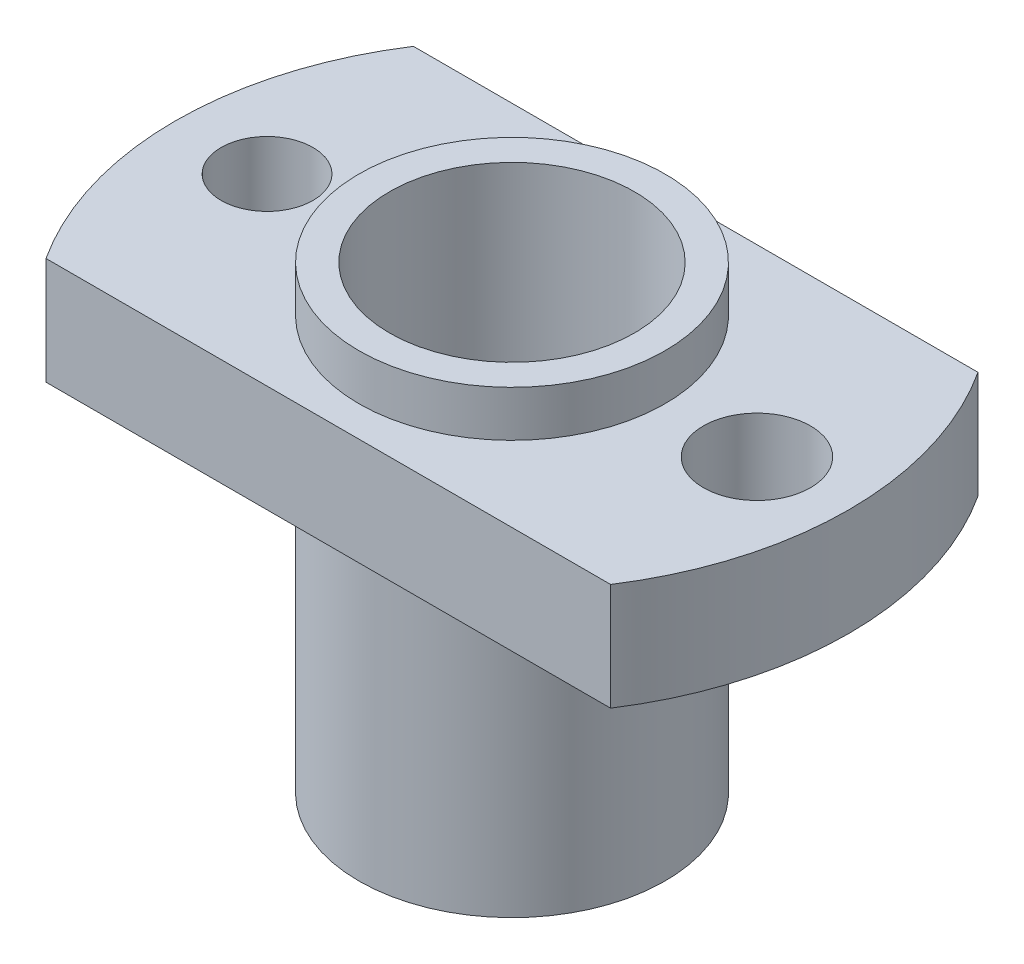
from build123d import *

# Parameters (mm, degrees)
EXTRUDE_1_DEPTH     = 3.5
CUT_EXTRUDE_START   = 3.5
SKETCH_2_R          = 1.75
SKETCH_2_R_2        = 1.5
CUT_EXTRUDE_1_DEPTH = 3.5
SKETCH_3_R          = 5
EXTRUDE_2_DEPTH     = 10
EXTRUDE_START       = 5
SKETCH_4_R          = 5
EXTRUDE_3_DEPTH     = 1.5
CUT_EXTRUDE_START_2 = -10
SKETCH_5_R          = 4
CUT_EXTRUDE_2_DEPTH = 15


with BuildPart() as part:
    # 草图1 → 凸台-拉伸1 (new body)
    with BuildSketch(Plane(origin=(0, 0, 0), x_dir=(1, 0, 0), z_dir=(0, 1, 0))):
        with BuildLine():
            Line((-9.219544457, 6), (9.219544457, 6))
            ThreePointArc((9.219544457, 6), (11, 0), (9.219544457, -6))
            Line((9.219544457, -6), (-9.219544457, -6))
            ThreePointArc((-9.219544457, -6), (-11, 0), (-9.219544457, 6))
        make_face()
    extrude(amount=EXTRUDE_1_DEPTH)

    # 草图2 → 切除-拉伸1 (cut)
    with BuildSketch(Plane(origin=(0, 0, 0), x_dir=(1, 0, 0), z_dir=(0, 1, 0)).offset(CUT_EXTRUDE_START)):
        with Locations(Location((8, 0, 0), (0, 0, 270))):
            Circle(SKETCH_2_R)
        with Locations(Location((-8, 0, 0), (0, 0, 270))):
            Circle(SKETCH_2_R_2)
    extrude(amount=-CUT_EXTRUDE_1_DEPTH, mode=Mode.SUBTRACT)

    # 草图3 → 凸台-拉伸2 (add)
    with BuildSketch(Plane(origin=(0, 0, 0), x_dir=(1, 0, 0), z_dir=(0, 1, 0))):
        with Locations(Location((0, 0, 0), (0, 0, 270))):
            Circle(SKETCH_3_R)
    extrude(amount=-EXTRUDE_2_DEPTH)

    # 草图4 → 凸台-拉伸3 (add)
    with BuildSketch(Plane(origin=(0, 0, 0), x_dir=(1, 0, 0), z_dir=(0, 1, 0)).offset(EXTRUDE_START)):
        with Locations(Location((0, 0, 0), (0, 0, 270))):
            Circle(SKETCH_4_R)
    extrude(amount=-EXTRUDE_3_DEPTH)

    # 草图5 → 切除-拉伸2 (cut)
    with BuildSketch(Plane(origin=(0, 0, 0), x_dir=(1, 0, 0), z_dir=(0, 1, 0)).offset(CUT_EXTRUDE_START_2)):
        with Locations(Location((0, 0, 0), (0, 0, 270))):
            Circle(SKETCH_5_R)
    extrude(amount=CUT_EXTRUDE_2_DEPTH, mode=Mode.SUBTRACT)


solid = part.part
